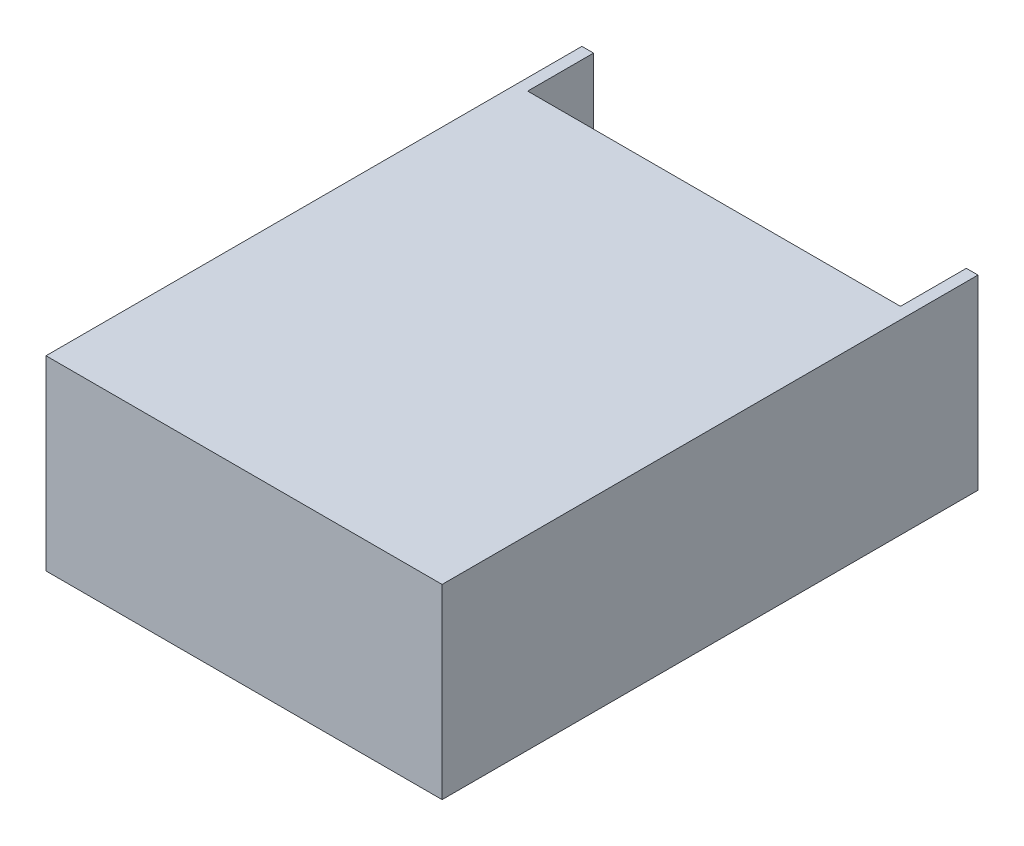
from build123d import *

# Parameters (mm, degrees)
SKETCH_1_W      = 17
SKETCH_1_H      = 23
EXTRUDE_1_DEPTH = 0.5
SKETCH_2_W      = 0.5
SKETCH_2_H      = 23
EXTRUDE_2_DEPTH = 7.5
SKETCH_3_W      = 16
SKETCH_3_H      = 20.172343548
EXTRUDE_3_DEPTH = 7.5
SKETCH_4_W      = 2.493920062
SKETCH_4_H      = 0.457616149
SKETCH_4_W_2    = 2.364028392
EXTRUDE_4_DEPTH = 0.5


with BuildPart() as part:
    # 草图1 → 凸台-拉伸1 (new body)
    with BuildSketch(Plane(origin=(0, 0, 0), x_dir=(1, 0, 0), z_dir=(0, 1, 0))):
        with Locations((8.5, 11.5)):
            Rectangle(SKETCH_1_W, SKETCH_1_H)
    extrude(amount=EXTRUDE_1_DEPTH)

    # 草图2 → 凸台-拉伸2 (add)
    with BuildSketch(Plane(origin=(0, 0.5, 0), x_dir=(1, 0, 0), z_dir=(0, 1, 0))):
        with Locations((0.25, 11.5)):
            Rectangle(SKETCH_2_W, SKETCH_2_H)
        with Locations((16.75, 11.5)):
            Rectangle(SKETCH_2_W, SKETCH_2_H)
    extrude(amount=EXTRUDE_2_DEPTH)

    # 草图3 → 凸台-拉伸3 (add)
    with BuildSketch(Plane(origin=(0, 0.5, 0), x_dir=(1, 0, 0), z_dir=(0, 1, 0))):
        with Locations((8.5, 10.086171774)):
            Rectangle(SKETCH_3_W, SKETCH_3_H)
    extrude(amount=EXTRUDE_3_DEPTH)

    # 草图4 → 凸台-拉伸4 (add)
    with BuildSketch(Plane(origin=(0, 0.5, 0), x_dir=(1, 0, 0), z_dir=(0, 1, 0))):
        with Locations((4.291509895, 23.228808075)):
            Rectangle(SKETCH_4_W, SKETCH_4_H)
        with Locations((11.968107586, 23.228808075)):
            Rectangle(SKETCH_4_W_2, SKETCH_4_H)
    extrude(amount=-EXTRUDE_4_DEPTH)


solid = part.part
